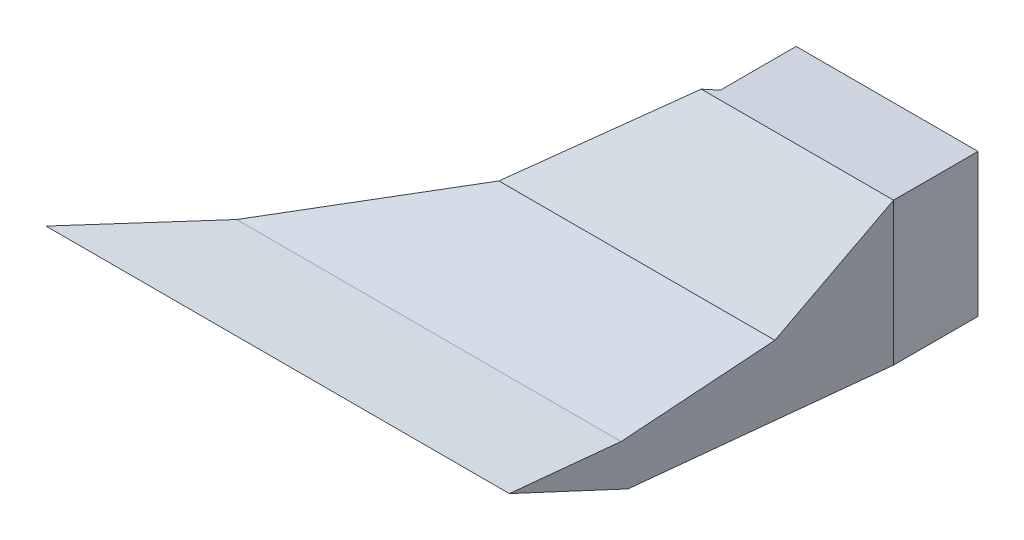
from build123d import *

# Parameters (mm, degrees)
SIDE_BASE_DEPTH                    = 0.8
SIDE_BASE_2_COUNT                  = 2
SIDE_BASE_2_PITCH                  = 50
FRONT_BACK_WALLS_REACH             = 60.566
BASE_SKETCH_W                      = 50.8
BASE_SKETCH_H                      = 13.2
BASE_SKETCH_W_2                    = 15.2
BASE_SKETCH_H_2                    = 11.276834123
BASE_DEPTH                         = 0.8
ATTACHMENT_BASE_SKETCH_W           = 16.8
ATTACHMENT_BASE_SKETCH_H           = 13.2
ATTACHMENT_BASE_SKETCH_W_2         = 15.2
ATTACHMENT_BASE_SKETCH_H_2         = 11.276834123
ATTACHMENT_BASE_DEPTH              = 7
PIPE_TOP_EXTRA_CUTAWAY_REACH       = 65.248
SKETCH11_W                         = 15.2
SKETCH11_H                         = 0.312130873
SKETCH1_W                          = 15.2
SKETCH1_H                          = 11.588964996
FAN_BASE_DEPTH                     = 0.1
LEFT_RIGHT_WALL_REMOVAL_DEPTH      = 59.566323483
LEFT_RIGHT_WALL_REMOVAL_DEPTH_BACK = 59.566323483
SKETCH6_W                          = 28.631700026
SKETCH6_H                          = 16.366666667
CUTAWAY_LEFT_DEPTH                 = 54.208577359
LEFT_WALL_DEPTH                    = 0.8331843
SKETCH9_W                          = 44.231215268
SKETCH9_H                          = 16.366666667
CUTAWAY_RIGHT_DEPTH                = 47.338131648
RIGHT_WALL_DEPTH                   = 1.25073473


with BuildPart() as part:
    # Side base sketch → Side base (new body)
    with BuildSketch(Plane.ZY):
        Polygon((0, 13.2), (8.491348573, 5), (19.491348573, 0.8030407), (27.491348573, -0.530292633), (19, -3.166666667), (6, -1), (0, 0), align=None)
    extrude(amount=-SIDE_BASE_DEPTH)


with BuildPart() as side_base_2_1:
    # Side base 2: pattern copy
    add(part.part.moved(Location(Vector(1, 0, 0) * (1 * SIDE_BASE_2_PITCH))))

    # Wall base sketch → Front back walls (add, up to next)
    with BuildSketch(Plane(origin=(0.8, 0, 0), x_dir=(0, 0, -1), z_dir=(1, 0, 0)), mode=Mode.PRIVATE) as front_back_walls_sk1:
        Polygon((0, 12.087869127), (-8.053310036, 4.310878025), (-19.280914859, 0.027077982), (-25.791579847, -1.058032849), (-27.491348573, -0.530292633), (-19.491348573, 0.8030407), (-8.491348573, 5), (0, 13.2), align=None)
    front_back_walls_tool1 = extrude(front_back_walls_sk1.sketch, amount=FRONT_BACK_WALLS_REACH, mode=Mode.PRIVATE) - side_base_2_1.part
    # Wall base sketch → Front back walls (add, up to next)
    with BuildSketch(Plane(origin=(0.8, 0, 0), x_dir=(0, 0, -1), z_dir=(1, 0, 0)), mode=Mode.PRIVATE) as front_back_walls_sk2:
        Polygon((0, 0.811035004), (-19, -2.355631663), (-19, -3.166666667), (0, 0), align=None)
    front_back_walls_tool2 = extrude(front_back_walls_sk2.sketch, amount=FRONT_BACK_WALLS_REACH, mode=Mode.PRIVATE) - side_base_2_1.part

    add(part.part)  # Front back walls merges part
    add(front_back_walls_tool1.solids().sort_by_distance((0.8, 8.422144, 4.241782))[0])
    add(front_back_walls_tool2.solids().sort_by_distance((0.8, -1.177816, 9.5))[0])

    # Base sketch → Base (add)
    with BuildSketch(Plane(origin=(0, 0, 0), x_dir=(-1, 0, 0), z_dir=(0, 0, -1))):
        with Locations((-25.4, 6.6)):
            Rectangle(BASE_SKETCH_W, BASE_SKETCH_H)
        with Locations((-42.4, 6.449452066)):
            Rectangle(BASE_SKETCH_W_2, BASE_SKETCH_H_2, mode=Mode.SUBTRACT)
    extrude(amount=BASE_DEPTH)

    # Attachment base sketch → Attachment base (add)
    with BuildSketch(Plane(origin=(0, 0, -0.8), x_dir=(-1, 0, 0), z_dir=(0, 0, -1))):
        with Locations((-42.4, 6.6)):
            Rectangle(ATTACHMENT_BASE_SKETCH_W, ATTACHMENT_BASE_SKETCH_H)
        with Locations((-42.4, 6.449452066)):
            Rectangle(ATTACHMENT_BASE_SKETCH_W_2, ATTACHMENT_BASE_SKETCH_H_2, mode=Mode.SUBTRACT)
    extrude(amount=ATTACHMENT_BASE_DEPTH)

    # Pipe top extra cutaway: up to this plane
    pipe_top_extra_cutaway_end = Plane(origin=(500000, 12.087869127, 0), z_dir=(0, 0.7193398003386524, 0.6946583704589959))
    # Sketch11 → Pipe top extra cutaway (cut, up to the surface)
    with BuildSketch(Plane(origin=(0, 0, -7.8), x_dir=(-1, 0, 0), z_dir=(0, 0, -1)), mode=Mode.PRIVATE) as pipe_top_extra_cutaway_sk1:
        with Locations((-42.4, 12.243934564)):
            Rectangle(SKETCH11_W, SKETCH11_H)
    pipe_top_extra_cutaway_tool1 = split(extrude(pipe_top_extra_cutaway_sk1.sketch, amount=-PIPE_TOP_EXTRA_CUTAWAY_REACH, mode=Mode.PRIVATE), bisect_by=pipe_top_extra_cutaway_end, keep=Keep.BOTH, mode=Mode.PRIVATE)
    add(pipe_top_extra_cutaway_tool1.solids().sort_by_distance((42.4, 12.243935, -7.8))[0], mode=Mode.SUBTRACT)

    # Sketch4 → Left right wall removal (cut, two sides: drawn at the far end of the back side and taken through both)
    with BuildSketch(Plane(origin=(0.8, 0, 0), x_dir=(0, 0, -1), z_dir=(1, 0, 0)).offset(-LEFT_RIGHT_WALL_REMOVAL_DEPTH_BACK)):
        Polygon((-25.791579847, -1.058032849), (-19, -3.166666667), (-19, -2.355631663), (0, 0.811035004), (0, 12.087869127), (-8.053310036, 4.310878025), (-19.280914859, 0.027077982), align=None)
    extrude(amount=LEFT_RIGHT_WALL_REMOVAL_DEPTH + LEFT_RIGHT_WALL_REMOVAL_DEPTH_BACK, mode=Mode.SUBTRACT)

    # Sketch6 → Cutaway left (cut, through all)
    with BuildSketch(Plane(origin=(46.834030083, 0, 13.628732678), x_dir=(0.27941058312270783, 0, -0.9601717169543313), z_dir=(0.9601717169543312, 0, 0.2794105831227078))):
        with Locations((-0.12179239, 5.016666667)):
            Rectangle(SKETCH6_W, SKETCH6_H)
    extrude(amount=CUTAWAY_LEFT_DEPTH, mode=Mode.SUBTRACT)

    # Sketch7 → Left wall (add, along a direction that is not the sketch's normal)
    with BuildSketch(Plane(origin=(46.834030083, 0, 13.628732678), x_dir=(0.27941058312270806, 0, -0.9601717169543312), z_dir=(0.9601717169543312, 0, 0.27941058312270806))):
        Polygon((-5.594069506, -2.355631663), (-5.594069506, -3.166666667), (-12.667366633, -1.058032849), (-5.886636818, 0.027077982), (5.806693265, 4.310878025), (14.194057623, 12.087869127), (14.194057623, 0.811035004), align=None)
    extrude(amount=-LEFT_WALL_DEPTH, dir=(1, 0, 0))

    # Sketch9 → Cutaway right (cut, through all)
    with BuildSketch(Plane(origin=(13.516705988, 0, 16.244117965), x_dir=(0.7686879004792403, 0, -0.6396240393049794), z_dir=(0.6396240393049794, -1.3449343476138912e-15, 0.7686879004792403))):
        with Locations((4.531480214, 5.016666667)):
            Rectangle(SKETCH9_W, SKETCH9_H)
    extrude(amount=-CUTAWAY_RIGHT_DEPTH, mode=Mode.SUBTRACT)

    # Sketch10 → Right wall (add, along a direction that is not the sketch's normal)
    with BuildSketch(Plane(origin=(13.516705988, 0, 16.244117965), x_dir=(-0.7686879004792402, -2.570451750162017e-15, 0.6396240393049794), z_dir=(-0.6396240393049794, 1.2488685157059335e-15, -0.7686879004792402))):
        Polygon((-25.396353118, 12.087869127), (-25.396353118, 0.811035004), (4.308596716, -2.355631663), (4.308596716, -3.166666667), (14.926677697, -1.058032849), (4.747784179, 0.027077982), (-12.805659927, 4.310878025), align=None)
    extrude(amount=-RIGHT_WALL_DEPTH, dir=(-1, 0, 0))


with BuildPart() as body_2:
    # Sketch1 → Fan base (new body)
    with BuildSketch(Plane(origin=(0, 0, -7.8), x_dir=(-1, 0, 0), z_dir=(0, 0, -1))):
        with Locations((-42.4, 6.605517502)):
            Rectangle(SKETCH1_W, SKETCH1_H)
    extrude(amount=FAN_BASE_DEPTH)


solid = Compound([side_base_2_1.part, body_2.part])
